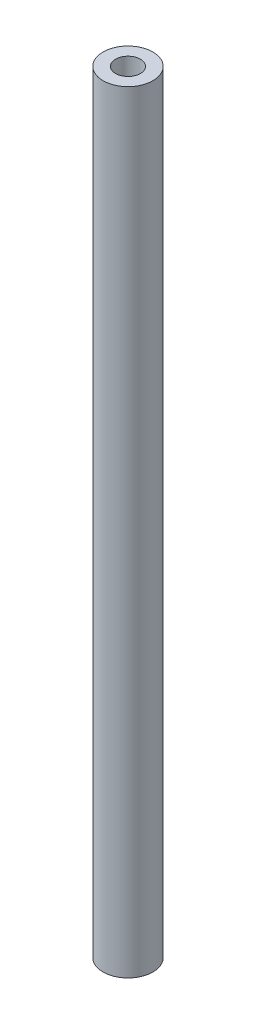
from build123d import *

# Parameters (mm, degrees)
SKETCH1_R           = 2
SKETCH1_R_2         = 1
BOSS_EXTRUDE1_DEPTH = 62


with BuildPart() as part:
    # Sketch1 → Boss-Extrude1 (new body)
    with BuildSketch(Plane(origin=(0, 0, 0), x_dir=(1, 0, 0), z_dir=(0, 1, 0))):
        with Locations(Location((0, 0, 0), (0, 0, 270))):
            Circle(SKETCH1_R)
        with Locations(Location((0, 0, 0), (0, 0, 270))):
            Circle(SKETCH1_R_2, mode=Mode.SUBTRACT)
    extrude(amount=BOSS_EXTRUDE1_DEPTH)


solid = part.part
